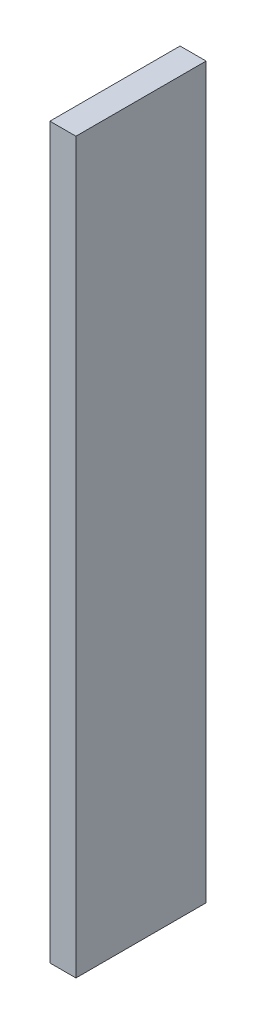
from build123d import *

# Parameters (mm, degrees)
ESQUISSE1_W        = 50
ESQUISSE1_H        = 280
BOSS_EXTRU_1_DEPTH = 10


with BuildPart() as part:
    # Esquisse1 → Boss.-Extru.1 (new body)
    with BuildSketch(Plane(origin=(0, 0, 0), x_dir=(0, 0, -1), z_dir=(1, 0, 0))):
        Rectangle(ESQUISSE1_W, ESQUISSE1_H)
    extrude(amount=BOSS_EXTRU_1_DEPTH)


solid = part.part
